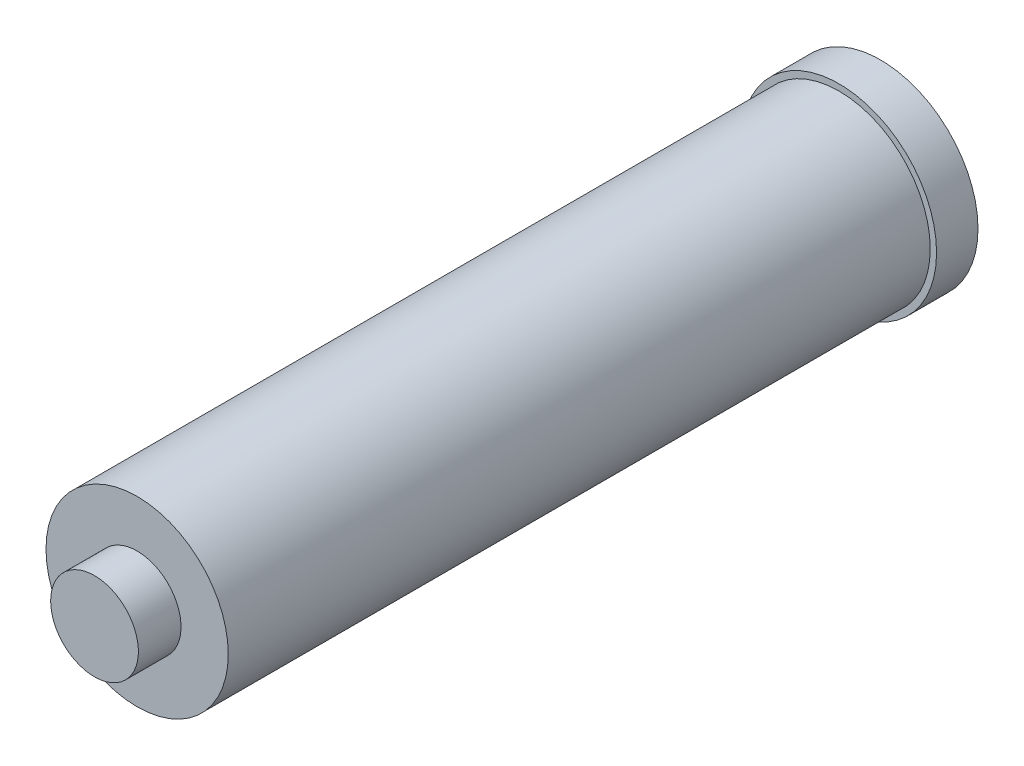
from build123d import *

# Parameters (mm, degrees)
SKETCH3_R           = 19
BOSS_EXTRUDE1_DEPTH = 146.35
SKETCH4_R           = 20.32
BOSS_EXTRUDE2_DEPTH = 8.636
SKETCH5_R           = 9.144
BOSS_EXTRUDE3_DEPTH = 8.89


with BuildPart() as part:
    # Sketch3 → Boss-Extrude1 (new body)
    with BuildSketch(Plane.XY):
        Circle(SKETCH3_R)
    extrude(amount=BOSS_EXTRUDE1_DEPTH)

    # Sketch4 → Boss-Extrude2 (add)
    with BuildSketch(Plane(origin=(0, 0, 0), x_dir=(-1, 0, 0), z_dir=(0, 0, -1))):
        Circle(SKETCH4_R)
    extrude(amount=BOSS_EXTRUDE2_DEPTH)

    # Sketch5 → Boss-Extrude3 (add)
    with BuildSketch(Plane.XY.offset(146.35)):
        with Locations(Location((0, 0, 0), (0, 0, 180))):
            Circle(SKETCH5_R)
    extrude(amount=BOSS_EXTRUDE3_DEPTH)


solid = part.part
